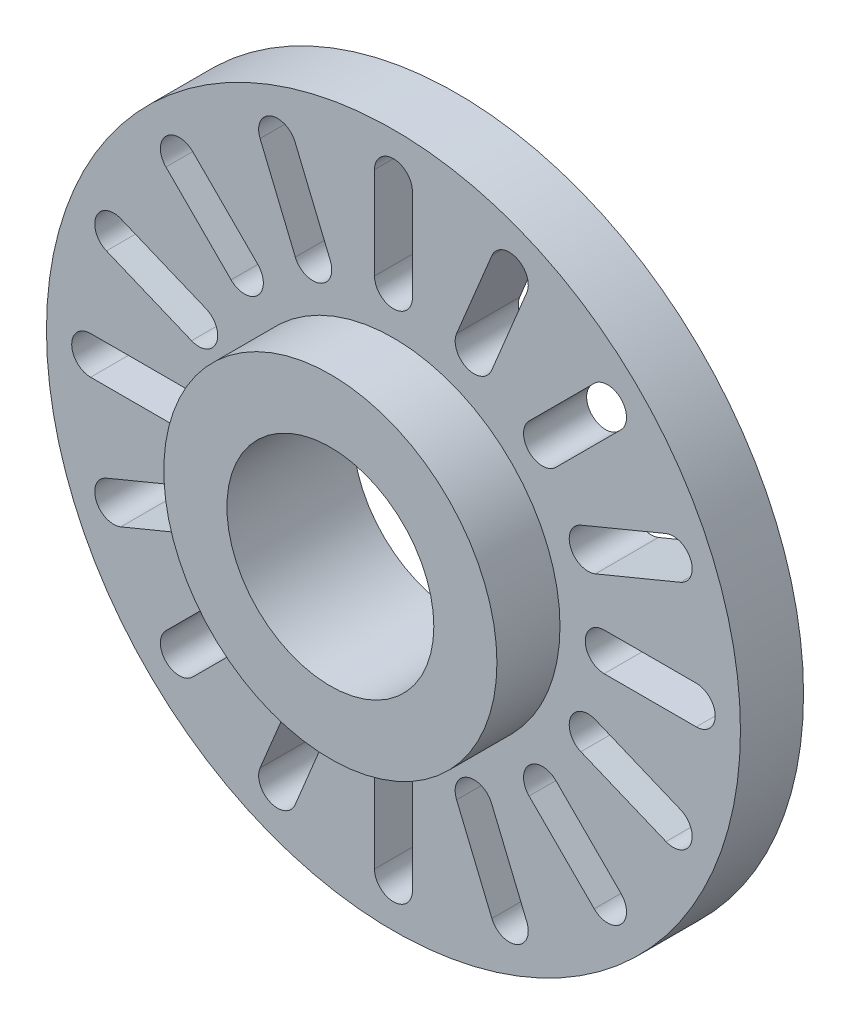
from build123d import *

# Parameters (mm, degrees)
SKETCH1_R               = 13.75
SKETCH1_R_2             = 4.1
BOSS_EXTRUDE1_DEPTH     = 2.5
SKETCH2_R               = 6.6
SKETCH2_R_2             = 4.1
BOSS_EXTRUDE2_DEPTH     = 2.5
CUT_EXTRUDE1_DEPTH      = 20.605483927
CUT_EXTRUDE1_DEPTH_BACK = 20.605483927
SKETCH3_R               = 0.75


with BuildPart() as part:
    # Sketch1 → Boss-Extrude1 (new body)
    with BuildSketch(Plane.XY):
        Circle(SKETCH1_R)
        Circle(SKETCH1_R_2, mode=Mode.SUBTRACT)
    extrude(amount=BOSS_EXTRUDE1_DEPTH)

    # Sketch2 → Boss-Extrude2 (add)
    with BuildSketch(Plane.XY.offset(2.5)):
        Circle(SKETCH2_R)
        Circle(SKETCH2_R_2, mode=Mode.SUBTRACT)
    extrude(amount=BOSS_EXTRUDE2_DEPTH)

    # Sketch3 → Cut-Extrude1 (cut, two sides: drawn at the far end of the back side and taken through both)
    with BuildSketch(Plane.XY.offset(2.5).offset(-CUT_EXTRUDE1_DEPTH_BACK)):
        with BuildLine():
            ThreePointArc((0.75, 12), (0, 11.25), (-0.75, 12))
            Line((-0.75, 12), (-0.75, 8.35))
            ThreePointArc((-0.75, 8.35), (0, 9.1), (0.75, 8.35))
            Line((0.75, 8.35), (0.75, 12))
        make_face()
        with BuildLine():
            ThreePointArc((5.285110838, 10.799541816), (4.305188614, 10.393644741), (3.899291539, 11.373566964))
            Line((3.899291539, 11.373566964), (2.502497011, 8.001406671))
            ThreePointArc((2.502497011, 8.001406671), (3.341724402, 8.449983057), (3.94540666, 7.714394096))
            ThreePointArc((3.94540666, 7.714394096), (3.930995621, 7.568076355), (3.88831631, 7.427381522))
            Line((3.88831631, 7.427381522), (5.285110838, 10.799541816))
        make_face()
        with BuildLine():
            ThreePointArc((9.01561146, 7.954951288), (7.954951288, 7.954951288), (7.954951288, 9.01561146))
            Line((7.954951288, 9.01561146), (5.374011537, 6.434671709))
            ThreePointArc((5.374011537, 6.434671709), (6.191354197, 6.597251272), (6.654341623, 5.904341623))
            ThreePointArc((6.654341623, 5.904341623), (6.597251272, 5.617329049), (6.434671709, 5.374011537))
            Line((6.434671709, 5.374011537), (9.01561146, 7.954951288))
        make_face()
        with BuildLine():
            ThreePointArc((11.373566964, 3.899291539), (10.393644741, 4.305188614), (10.799541816, 5.285110838))
            Line((10.799541816, 5.285110838), (7.427381522, 3.88831631))
            ThreePointArc((7.427381522, 3.88831631), (8.131071771, 3.819008869), (8.464394096, 3.19540666))
            ThreePointArc((8.464394096, 3.19540666), (8.337996306, 2.778728985), (8.001406671, 2.502497011))
            Line((8.001406671, 2.502497011), (11.373566964, 3.899291539))
        make_face()
        with BuildLine():
            ThreePointArc((12, -0.75), (11.25, 0), (12, 0.75))
            Line((12, 0.75), (8.35, 0.75))
            ThreePointArc((8.35, 0.75), (8.880330086, 0.530330086), (9.1, 0))
            ThreePointArc((9.1, 0), (8.880330086, -0.530330086), (8.35, -0.75))
            Line((8.35, -0.75), (12, -0.75))
        make_face()
        with BuildLine():
            ThreePointArc((10.799541816, -5.285110838), (10.393644741, -4.305188614), (11.373566964, -3.899291539))
            Line((11.373566964, -3.899291539), (8.001406671, -2.502497011))
            ThreePointArc((8.001406671, -2.502497011), (8.337996306, -2.778728985), (8.464394096, -3.19540666))
            ThreePointArc((8.464394096, -3.19540666), (8.131071771, -3.819008869), (7.427381522, -3.88831631))
            Line((7.427381522, -3.88831631), (10.799541816, -5.285110838))
        make_face()
        with BuildLine():
            ThreePointArc((7.954951288, -9.01561146), (7.954951288, -7.954951288), (9.01561146, -7.954951288))
            Line((9.01561146, -7.954951288), (6.434671709, -5.374011537))
            ThreePointArc((6.434671709, -5.374011537), (6.597251272, -5.617329049), (6.654341623, -5.904341623))
            ThreePointArc((6.654341623, -5.904341623), (6.191354197, -6.597251272), (5.374011537, -6.434671709))
            Line((5.374011537, -6.434671709), (7.954951288, -9.01561146))
        make_face()
        with BuildLine():
            ThreePointArc((3.899291539, -11.373566964), (4.305188614, -10.393644741), (5.285110838, -10.799541816))
            Line((5.285110838, -10.799541816), (3.88831631, -7.427381522))
            ThreePointArc((3.88831631, -7.427381522), (3.930995621, -7.568076355), (3.94540666, -7.714394096))
            ThreePointArc((3.94540666, -7.714394096), (3.341724402, -8.449983057), (2.502497011, -8.001406671))
            Line((2.502497011, -8.001406671), (3.899291539, -11.373566964))
        make_face()
        with BuildLine():
            ThreePointArc((-0.75, -12), (0, -11.25), (0.75, -12))
            Line((0.75, -12), (0.75, -8.35))
            ThreePointArc((0.75, -8.35), (0, -9.1), (-0.75, -8.35))
            Line((-0.75, -8.35), (-0.75, -12))
        make_face()
        with BuildLine():
            ThreePointArc((-3.842201188, -11.08655439), (-3.856612228, -11.232872132), (-3.899291539, -11.373566964))
            Line((-3.899291539, -11.373566964), (-2.502497011, -8.001406671))
            ThreePointArc((-2.502497011, -8.001406671), (-3.482419235, -8.407303746), (-3.88831631, -7.427381522))
            Line((-3.88831631, -7.427381522), (-5.285110838, -10.799541816))
            ThreePointArc((-5.285110838, -10.799541816), (-4.445883447, -10.35096543), (-3.842201188, -11.08655439))
        make_face()
        with BuildLine():
            ThreePointArc((-7.735281374, -8.485281374), (-7.792371725, -8.772293949), (-7.954951288, -9.01561146))
            Line((-7.954951288, -9.01561146), (-5.374011537, -6.434671709))
            ThreePointArc((-5.374011537, -6.434671709), (-6.434671709, -6.434671709), (-6.434671709, -5.374011537))
            Line((-6.434671709, -5.374011537), (-9.01561146, -7.954951288))
            ThreePointArc((-9.01561146, -7.954951288), (-8.1982688, -7.792371725), (-7.735281374, -8.485281374))
        make_face()
        with BuildLine():
            ThreePointArc((-10.33655439, -4.592201188), (-10.462952181, -5.008878863), (-10.799541816, -5.285110838))
            Line((-10.799541816, -5.285110838), (-7.427381522, -3.88831631))
            ThreePointArc((-7.427381522, -3.88831631), (-8.407303746, -3.482419235), (-8.001406671, -2.502497011))
            Line((-8.001406671, -2.502497011), (-11.373566964, -3.899291539))
            ThreePointArc((-11.373566964, -3.899291539), (-10.669876715, -3.968598979), (-10.33655439, -4.592201188))
        make_face()
        with BuildLine():
            ThreePointArc((-11.25, 0), (-11.469669914, -0.530330086), (-12, -0.75))
            Line((-12, -0.75), (-8.35, -0.75))
            ThreePointArc((-8.35, -0.75), (-9.1, 0), (-8.35, 0.75))
            Line((-8.35, 0.75), (-12, 0.75))
            ThreePointArc((-12, 0.75), (-11.469669914, 0.530330086), (-11.25, 0))
        make_face()
        with BuildLine():
            ThreePointArc((-10.33655439, 4.592201188), (-10.669876715, 3.968598979), (-11.373566964, 3.899291539))
            Line((-11.373566964, 3.899291539), (-8.001406671, 2.502497011))
            ThreePointArc((-8.001406671, 2.502497011), (-8.407303746, 3.482419235), (-7.427381522, 3.88831631))
            Line((-7.427381522, 3.88831631), (-10.799541816, 5.285110838))
            ThreePointArc((-10.799541816, 5.285110838), (-10.462952181, 5.008878863), (-10.33655439, 4.592201188))
        make_face()
        with BuildLine():
            ThreePointArc((-7.735281374, 8.485281374), (-8.1982688, 7.792371725), (-9.01561146, 7.954951288))
            Line((-9.01561146, 7.954951288), (-6.434671709, 5.374011537))
            ThreePointArc((-6.434671709, 5.374011537), (-6.434671709, 6.434671709), (-5.374011537, 6.434671709))
            Line((-5.374011537, 6.434671709), (-7.954951288, 9.01561146))
            ThreePointArc((-7.954951288, 9.01561146), (-7.792371725, 8.772293949), (-7.735281374, 8.485281374))
        make_face()
        with BuildLine():
            ThreePointArc((-3.842201188, 11.08655439), (-4.445883447, 10.35096543), (-5.285110838, 10.799541816))
            Line((-5.285110838, 10.799541816), (-3.88831631, 7.427381522))
            ThreePointArc((-3.88831631, 7.427381522), (-3.482419235, 8.407303746), (-2.502497011, 8.001406671))
            Line((-2.502497011, 8.001406671), (-3.899291539, 11.373566964))
            ThreePointArc((-3.899291539, 11.373566964), (-3.856612228, 11.232872132), (-3.842201188, 11.08655439))
        make_face()
        with Locations((0, 12)):
            Circle(SKETCH3_R)
        with Locations((4.592201188, 11.08655439)):
            Circle(SKETCH3_R)
        with Locations((8.485281374, 8.485281374)):
            Circle(SKETCH3_R)
        with Locations((11.08655439, 4.592201188)):
            Circle(SKETCH3_R)
        with Locations((7.714394096, 3.19540666)):
            Circle(SKETCH3_R)
        with Locations((5.904341623, 5.904341623)):
            Circle(SKETCH3_R)
        with Locations((3.19540666, 7.714394096)):
            Circle(SKETCH3_R)
        with Locations((0, 8.35)):
            Circle(SKETCH3_R)
        with Locations((-4.592201188, 11.08655439)):
            Circle(SKETCH3_R)
        with Locations((-8.485281374, 8.485281374)):
            Circle(SKETCH3_R)
        with Locations((-11.08655439, 4.592201188)):
            Circle(SKETCH3_R)
        with Locations((-7.714394096, 3.19540666)):
            Circle(SKETCH3_R)
        with Locations((-5.904341623, 5.904341623)):
            Circle(SKETCH3_R)
        with Locations((-3.19540666, 7.714394096)):
            Circle(SKETCH3_R)
        with Locations((-12, 0)):
            Circle(SKETCH3_R)
        with Locations((-11.08655439, -4.592201188)):
            Circle(SKETCH3_R)
        with Locations((-8.485281374, -8.485281374)):
            Circle(SKETCH3_R)
        with Locations((-4.592201188, -11.08655439)):
            Circle(SKETCH3_R)
        with Locations((-8.35, 0)):
            Circle(SKETCH3_R)
        with Locations((-7.714394096, -3.19540666)):
            Circle(SKETCH3_R)
        with Locations((-5.904341623, -5.904341623)):
            Circle(SKETCH3_R)
        with Locations((-3.19540666, -7.714394096)):
            Circle(SKETCH3_R)
        with Locations((3.19540666, -7.714394096)):
            Circle(SKETCH3_R)
        with Locations((5.904341623, -5.904341623)):
            Circle(SKETCH3_R)
        with Locations((7.714394096, -3.19540666)):
            Circle(SKETCH3_R)
        with Locations((8.35, 0)):
            Circle(SKETCH3_R)
        with Locations((12, 0)):
            Circle(SKETCH3_R)
        with Locations((11.08655439, -4.592201188)):
            Circle(SKETCH3_R)
        with Locations((8.485281374, -8.485281374)):
            Circle(SKETCH3_R)
        with Locations((4.592201188, -11.08655439)):
            Circle(SKETCH3_R)
        with Locations((0, -12)):
            Circle(SKETCH3_R)
        with Locations((0, -8.35)):
            Circle(SKETCH3_R)
    extrude(amount=CUT_EXTRUDE1_DEPTH + CUT_EXTRUDE1_DEPTH_BACK, mode=Mode.SUBTRACT)


solid = part.part
